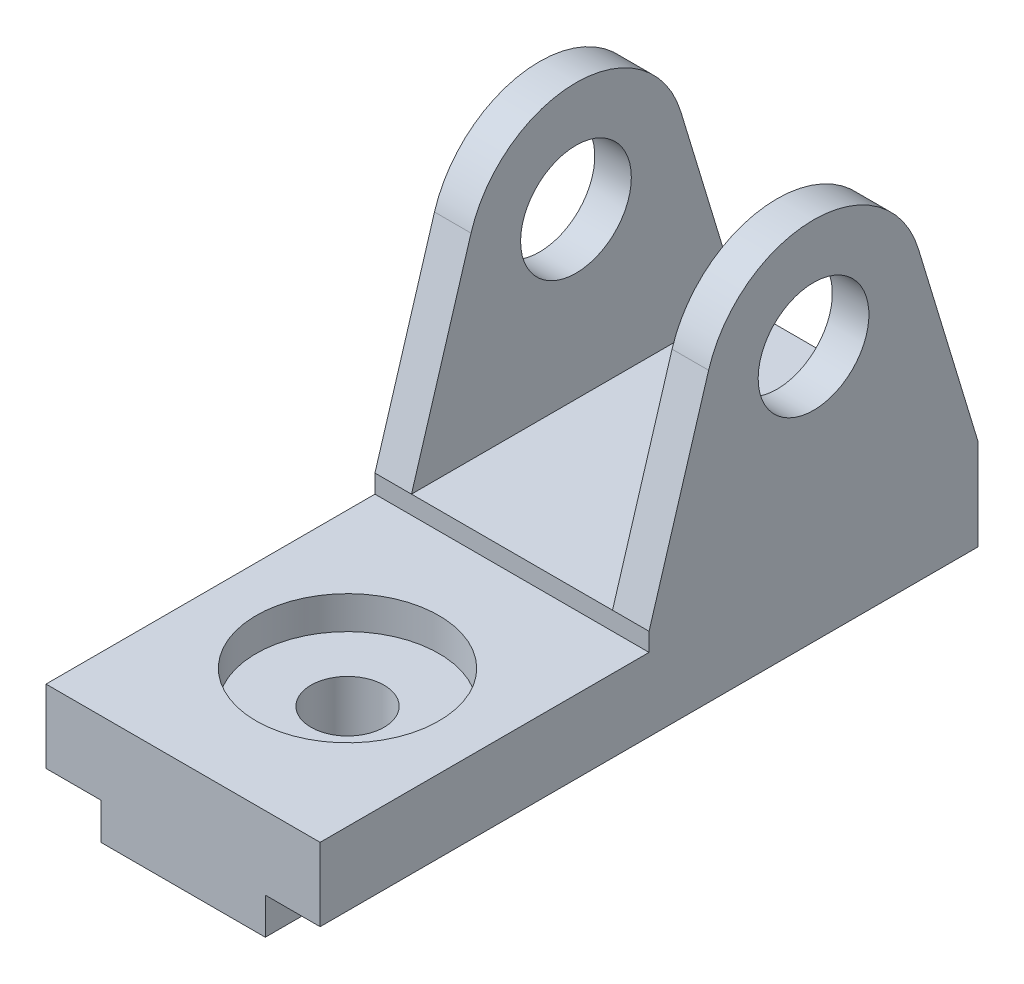
from build123d import *

# Parameters (mm, degrees)
SKETCH1_W           = 75
SKETCH1_H           = 180
BOSS_EXTRUDE1_DEPTH = 30
SKETCH2_W           = 15
SKETCH2_H           = 10
CUT_EXTRUDE1_DEPTH  = 187.296135226
SKETCH3_R           = 15.149621256
BOSS_EXTRUDE2_DEPTH = 75
CUT_EXTRUDE2_START  = 5
SKETCH4_W           = 55
SKETCH4_H           = 90
CUT_EXTRUDE2_DEPTH  = 122.119982556
HOLE1_D             = 20
HOLE1_CBORE_D       = 50
HOLE1_CBORE_DEPTH   = 9


with BuildPart() as part:
    # Sketch1 → Boss-Extrude1 (new body)
    with BuildSketch(Plane(origin=(0, 0, 0), x_dir=(1, 0, 0), z_dir=(0, 1, 0))):
        Rectangle(SKETCH1_W, SKETCH1_H)
    extrude(amount=BOSS_EXTRUDE1_DEPTH)

    # Sketch2 → Cut-Extrude1 (cut, through all)
    with BuildSketch(Plane.XY.offset(90)):
        with Locations((-30, 5)):
            Rectangle(SKETCH2_W, SKETCH2_H)
    cut_extrude1 = extrude(amount=-CUT_EXTRUDE1_DEPTH, mode=Mode.SUBTRACT)

    # Mirror1: Cut-Extrude1 across plane
    add(cut_extrude1.mirror(Plane(origin=(0, 0, 0), x_dir=(0, 0, 1), z_dir=(1, 0, 0))), mode=Mode.SUBTRACT)

    # Sketch3 → Boss-Extrude2 (add)
    with BuildSketch(Plane.ZY.offset(37.5)):
        with BuildLine():
            Line((-90, 30), (-90, 35))
            Line((-90, 35), (-73.708286934, 88.708286934))
            ThreePointArc((-73.708286934, 88.708286934), (-45, 110), (-16.291713066, 88.708286934))
            Line((-16.291713066, 88.708286934), (0, 35))
            Line((0, 35), (0, 30))
            Line((0, 30), (-90, 30))
        make_face()
        with Locations((-45, 80)):
            Circle(SKETCH3_R, mode=Mode.SUBTRACT)
    extrude(amount=-BOSS_EXTRUDE2_DEPTH)

    # Sketch4 → Cut-Extrude2 (cut, through all)
    with BuildSketch(Plane(origin=(0, 30, 0), x_dir=(1, 0, 0), z_dir=(0, 1, 0)).offset(CUT_EXTRUDE2_START)):
        with Locations((0, 45)):
            Rectangle(SKETCH4_W, SKETCH4_H)
    extrude(amount=CUT_EXTRUDE2_DEPTH, mode=Mode.SUBTRACT)

    # Hole1 (through all)
    with Locations(Plane(origin=(0, 30, 0), x_dir=(1, 0, 0), z_dir=(0, 1, 0))):
        with Locations((0, -45)):
            CounterBoreHole(HOLE1_D / 2, HOLE1_CBORE_D / 2, HOLE1_CBORE_DEPTH)


solid = part.part
